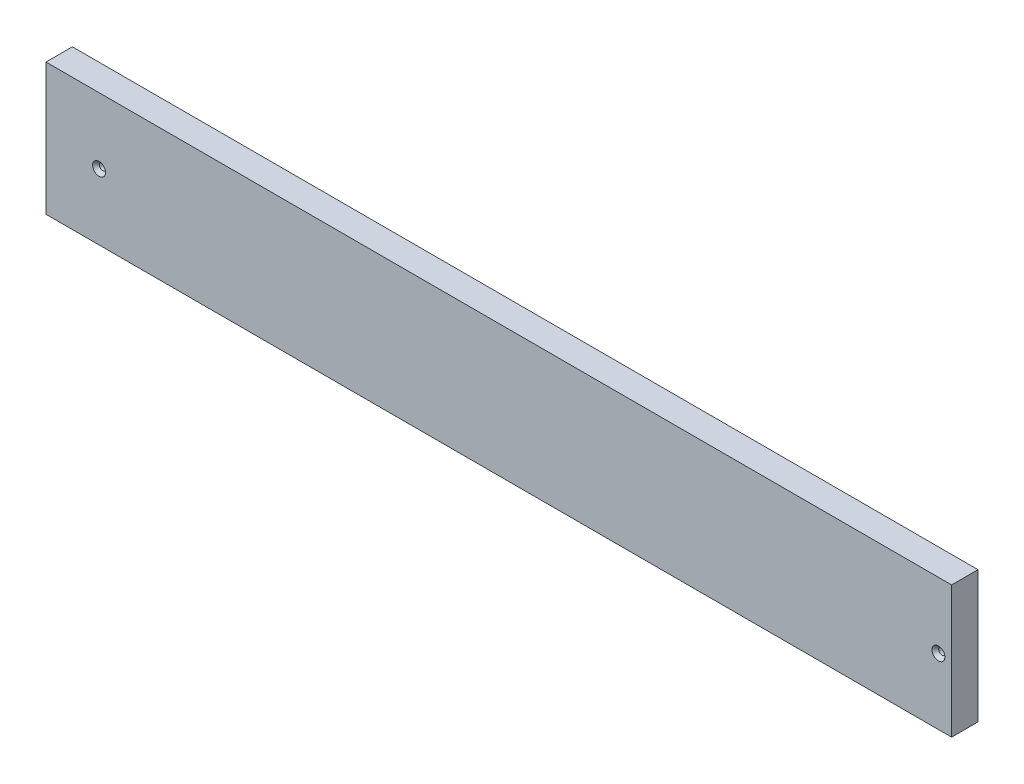
from build123d import *

# Parameters (mm, degrees)
SKETCH1_W                                         = 51.5
SKETCH1_H                                         = 7.5
BOSS_EXTRUDE1_DEPTH                               = 1.5
SCALE1_SCALE                                      = 10
CSK_FOR_6_FLAT_HEAD_SOCKET_CAP_SCREW4_D           = 3.81
CSK_FOR_6_FLAT_HEAD_SOCKET_CAP_SCREW4_CSINK_D     = 7.366
CSK_FOR_6_FLAT_HEAD_SOCKET_CAP_SCREW4_CSINK_ANGLE = 82
CSK_FOR_6_FLAT_HEAD_SOCKET_CAP_SCREW5_D           = 3.81
CSK_FOR_6_FLAT_HEAD_SOCKET_CAP_SCREW5_CSINK_D     = 7.366
CSK_FOR_6_FLAT_HEAD_SOCKET_CAP_SCREW5_CSINK_ANGLE = 82


with BuildPart() as part:
    # Sketch1 → Boss-Extrude1 (new body)
    with BuildSketch(Plane.XY):
        with Locations((25.75, 3.75)):
            Rectangle(SKETCH1_W, SKETCH1_H)
    extrude(amount=BOSS_EXTRUDE1_DEPTH)


with BuildPart() as part_1:
    # Scale1: scaled about (0, 0, 0)
    add(part.part.scale(SCALE1_SCALE))

    # CSK for #6 Flat Head Socket Cap Screw4 (through all)
    with Locations(Plane(origin=(-500, -171.918477494, 15), x_dir=(0, 1, 0), z_dir=(0, 0, 1))):
        with Locations((209.418477494, -1007.5)):
            CounterSinkHole(CSK_FOR_6_FLAT_HEAD_SOCKET_CAP_SCREW4_D / 2, CSK_FOR_6_FLAT_HEAD_SOCKET_CAP_SCREW4_CSINK_D / 2, counter_sink_angle=CSK_FOR_6_FLAT_HEAD_SOCKET_CAP_SCREW4_CSINK_ANGLE)

    # CSK for #6 Flat Head Socket Cap Screw5 (through all)
    with Locations(Plane(origin=(-500, -171.918477494, 15), x_dir=(0, 1, 0), z_dir=(0, 0, 1))):
        with Locations((209.418477494, -530.194488108)):
            CounterSinkHole(CSK_FOR_6_FLAT_HEAD_SOCKET_CAP_SCREW5_D / 2, CSK_FOR_6_FLAT_HEAD_SOCKET_CAP_SCREW5_CSINK_D / 2, counter_sink_angle=CSK_FOR_6_FLAT_HEAD_SOCKET_CAP_SCREW5_CSINK_ANGLE)


solid = part_1.part
